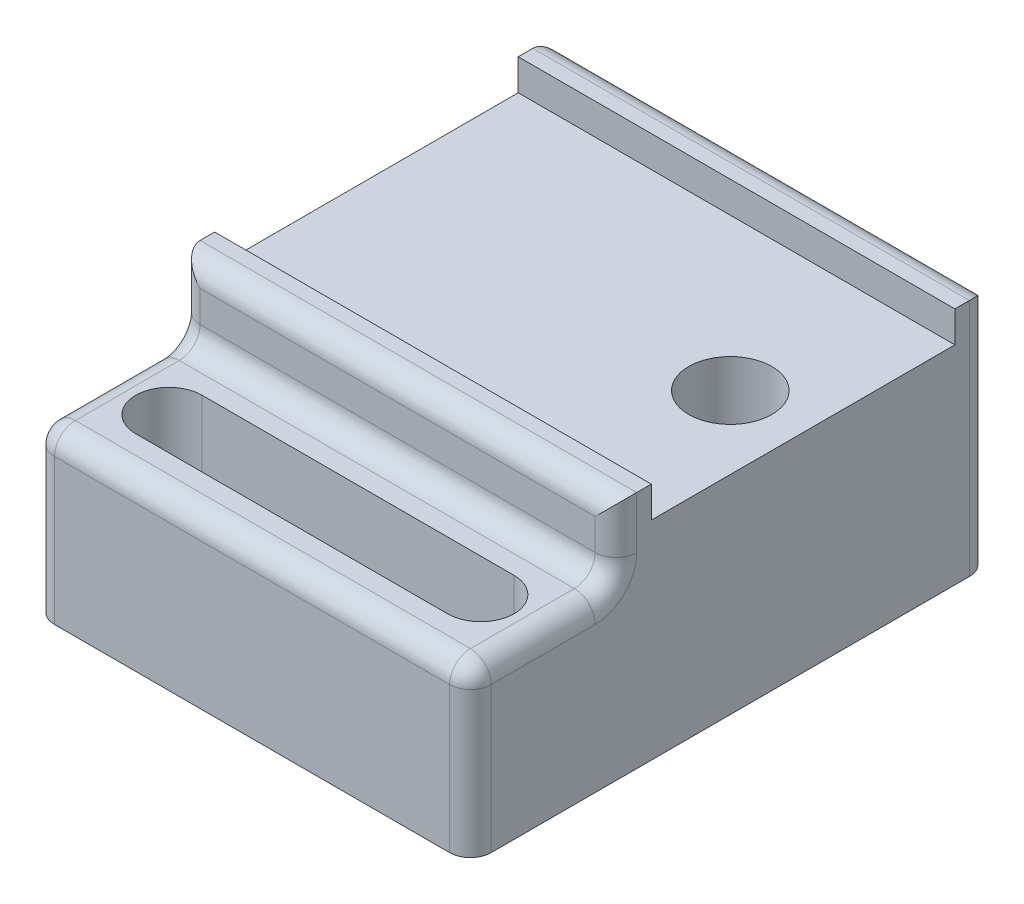
from build123d import *

# Parameters (mm, degrees)
SKETCH1_W           = 21
SKETCH1_H           = 14.6
BOSS_EXTRUDE1_DEPTH = 10
SKETCH1_3_W         = 21
SKETCH1_3_H         = 1.7
BOSS_EXTRUDE2_DEPTH = 11.5
SKETCH3_W           = 21
SKETCH3_H           = 7
BOSS_EXTRUDE4_DEPTH = 8
FILLET1_R           = 1
CUT_EXTRUDE1_DEPTH  = 21.742468513
SKETCH5_R           = 2
CUT_EXTRUDE2_DEPTH  = 6.8


with BuildPart() as part:
    # Sketch1 → Boss-Extrude1 (new body)
    with BuildSketch(Plane(origin=(0, 0, 0), x_dir=(1, 0, 0), z_dir=(0, 1, 0))):
        Rectangle(SKETCH1_W, SKETCH1_H)
    extrude(amount=BOSS_EXTRUDE1_DEPTH)

    # Sketch1<3> → Boss-Extrude2 (add)
    with BuildSketch(Plane(origin=(0, 0, 0), x_dir=(1, 0, 0), z_dir=(0, 1, 0))):
        with Locations((0, 8.15)):
            Rectangle(SKETCH1_3_W, SKETCH1_3_H)
        with Locations((0, -8.15)):
            Rectangle(SKETCH1_3_W, SKETCH1_3_H)
    extrude(amount=BOSS_EXTRUDE2_DEPTH)

    # Sketch3 → Boss-Extrude4 (add)
    with BuildSketch(Plane(origin=(0, 0, 0), x_dir=(1, 0, 0), z_dir=(0, 1, 0))):
        with Locations((0, -12.5)):
            Rectangle(SKETCH3_W, SKETCH3_H)
    extrude(amount=BOSS_EXTRUDE4_DEPTH)

    # Fillet1
    fillet1_edges = [part.edges().sort_by_distance(p)[0] for p in [
        (10.5, 8, 12.5),
        (-10.5, 9.75, 9),
        (10.5, 5.75, -9),
        (0, 11.5, 9),
        (-10.5, 5.75, -9),
        (0, 11.5, -9),
        (-10.5, 4, 16),
        (10.5, 4, 16),
        (0, 8, 16),
        (10.5, 9.75, 9),
        (-10.5, 8, 12.5),
        (0, 8, 9),
    ]]
    fillet(fillet1_edges, radius=FILLET1_R)

    # Sketch4 → Cut-Extrude1 (cut, through all)
    with BuildSketch(Plane(origin=(0, 8, 0), x_dir=(1, 0, 0), z_dir=(0, 1, 0))):
        with BuildLine():
            Line((-7.5, -10.9), (7.5, -10.9))
            ThreePointArc((7.5, -10.9), (9.1, -12.5), (7.5, -14.1))
            Line((7.5, -14.1), (-7.5, -14.1))
            ThreePointArc((-7.5, -14.1), (-9.1, -12.5), (-7.5, -10.9))
        make_face()
    extrude(amount=-CUT_EXTRUDE1_DEPTH, mode=Mode.SUBTRACT)

    # Sketch5 → Cut-Extrude2 (cut)
    with BuildSketch(Plane(origin=(0, 10, 0), x_dir=(1, 0, 0), z_dir=(0, 1, 0))):
        with Locations((7, 0)):
            Circle(SKETCH5_R)
    extrude(amount=-CUT_EXTRUDE2_DEPTH, mode=Mode.SUBTRACT)


solid = part.part
